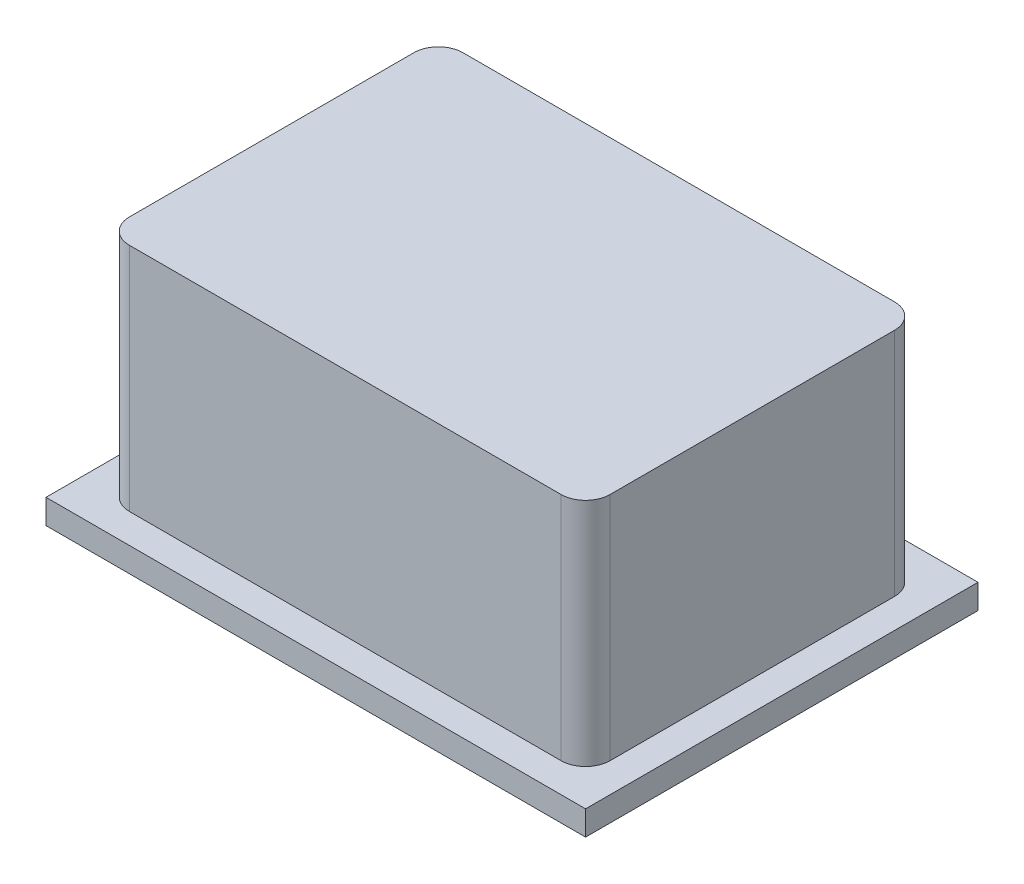
from build123d import *

# Parameters (mm, degrees)
SKETCH1_W           = 9.8
SKETCH1_H           = 6.8
BOSS_EXTRUDE1_DEPTH = 4.7
SKETCH2_W           = 11
SKETCH2_H           = 8
BOSS_EXTRUDE2_DEPTH = 0.5
SKETCH3_W           = 8
SKETCH3_H           = 5
CUT_EXTRUDE1_DEPTH  = 3.7
FILLET1_R           = 0.5


with BuildPart() as part:
    # Sketch1 → Boss-Extrude1 (new body)
    with BuildSketch(Plane(origin=(0, 0, 0), x_dir=(1, 0, 0), z_dir=(0, 1, 0))):
        with Locations((4.9, 3.4)):
            Rectangle(SKETCH1_W, SKETCH1_H)
    extrude(amount=BOSS_EXTRUDE1_DEPTH)

    # Sketch2 → Boss-Extrude2 (add)
    with BuildSketch(Plane.XZ):
        with Locations((4.9, -3.4)):
            Rectangle(SKETCH2_W, SKETCH2_H)
    extrude(amount=BOSS_EXTRUDE2_DEPTH)

    # Sketch3 → Cut-Extrude1 (cut)
    with BuildSketch(Plane.XZ.offset(0.5)):
        with Locations((4.9, -3.4)):
            Rectangle(SKETCH3_W, SKETCH3_H)
    extrude(amount=-CUT_EXTRUDE1_DEPTH, mode=Mode.SUBTRACT)

    # Fillet1
    fillet1_edges = [part.edges().sort_by_distance(p)[0] for p in [
        (0, 2.35, -6.8),
        (9.8, 2.35, -6.8),
        (9.8, 2.35, 0),
        (0, 2.35, 0),
    ]]
    fillet(fillet1_edges, radius=FILLET1_R)


solid = part.part
